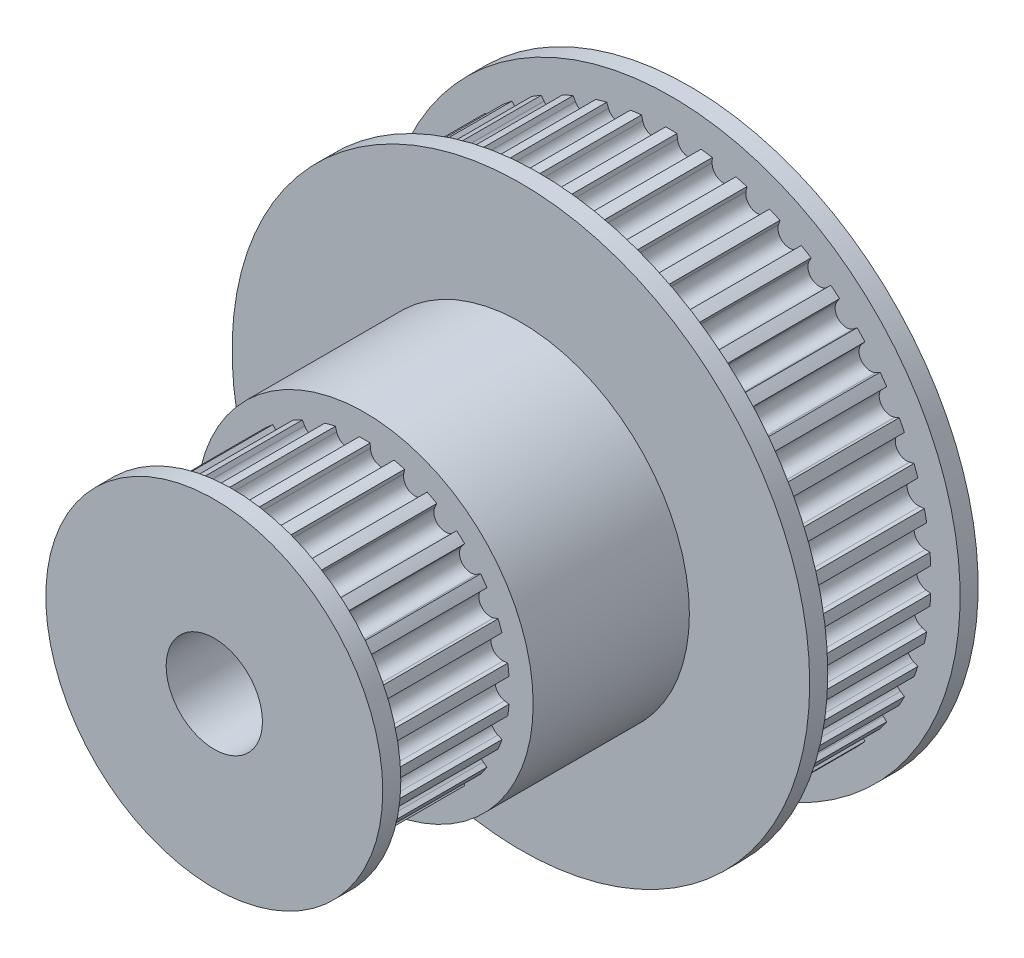
from build123d import *

# Parameters (mm, degrees)
SKETCH1_R               = 4
BOSS_EXTRUDE1_DEPTH     = 11
SKETCH2_R               = 4
BOSS_EXTRUDE2_DEPTH     = 11
SKETCH3_R               = 24
BOSS_EXTRUDE3_DEPTH     = 1.5
BOSS_EXTRUDE4_START     = 1.5
SKETCH4_R               = 24
BOSS_EXTRUDE4_DEPTH     = 1.5
SKETCH5_R               = 14
BOSS_EXTRUDE5_DEPTH     = 1.5
SKETCH6_R               = 14
BOSS_EXTRUDE6_DEPTH     = 12.98
CUT_EXTRUDE1_DEPTH      = 53.064098955
CUT_EXTRUDE1_DEPTH_BACK = 53.064098955
SKETCH7_R               = 4


with BuildPart() as part:
    # Sketch1 → Boss-Extrude1 (new body)
    with BuildSketch(Plane.XY):
        with BuildLine():
            Line((-0.473420512, 21.574806442), (-0.509853107, 21.1905942))
            ThreePointArc((-0.509853107, 21.1905942), (-1.390780384, 20.332489516), (-2.380347897, 21.062648851))
            Line((-2.380347897, 21.062648851), (-2.46875805, 21.438321615))
            ThreePointArc((-2.46875805, 21.438321615), (-2.938476287, 21.379002715), (-3.406780146, 21.309393446))
            Line((-3.406780146, 21.309393446), (-3.390556512, 20.923798873))
            ThreePointArc((-3.390556512, 20.923798873), (-4.146433546, 19.953733707), (-5.226207523, 20.542346206))
            Line((-5.226207523, 20.542346206), (-5.364948321, 20.90248142))
            ThreePointArc((-5.364948321, 20.90248142), (-5.822214322, 20.779755061), (-6.276677912, 20.647026769))
            Line((-6.276677912, 20.647026769), (-6.208100265, 20.267232762))
            ThreePointArc((-6.208100265, 20.267232762), (-6.824846496, 19.203277593), (-7.974712792, 19.639378519))
            Line((-7.974712792, 19.639378519), (-8.161199756, 19.977267545))
            ThreePointArc((-8.161199756, 19.977267545), (-8.597495519, 19.793419886), (-9.029653044, 19.600045049))
            Line((-9.029653044, 19.600045049), (-8.909998855, 19.233126452))
            ThreePointArc((-8.909998855, 19.233126452), (-9.376125469, 18.095100751), (-10.57466425, 18.37056637))
            Line((-10.57466425, 18.37056637), (-10.805423481, 18.679914973))
            ThreePointArc((-10.805423481, 18.679914973), (-11.212621642, 18.43837075), (-11.614422824, 18.187951574))
            Line((-11.614422824, 18.187951574), (-11.445921026, 17.840743387))
            ThreePointArc((-11.445921026, 17.840743387), (-11.752744965, 16.64984642), (-12.977629721, 16.759545327))
            Line((-12.977629721, 16.759545327), (-13.24836261, 17.03459093))
            ThreePointArc((-13.24836261, 17.03459093), (-13.618877839, 16.739849653), (-13.982837883, 16.437050974))
            Line((-13.982837883, 16.437050974), (-13.768627344, 16.116021029))
            ThreePointArc((-13.768627344, 16.116021029), (-13.910433059, 14.894436952), (-15.138846505, 14.836325665))
            Line((-15.138846505, 14.836325665), (-15.444509812, 15.071944688))
            ThreePointArc((-15.444509812, 15.071944688), (-15.771440109, 14.729496831), (-16.090779129, 14.379959215))
            Line((-16.090779129, 14.379959215), (-15.834850186, 14.091087691))
            ThreePointArc((-15.834850186, 14.091087691), (-15.808996105, 12.861572305), (-17.018055222, 12.636733327))
            Line((-17.018055222, 12.636733327), (-17.352955017, 12.828536634))
            ThreePointArc((-17.352955017, 12.828536634), (-17.630210291, 12.444761351), (-17.898979604, 12.054996024))
            Line((-17.898979604, 12.054996024), (-17.60609973, 11.803664051))
            ThreePointArc((-17.60609973, 11.803664051), (-17.413067465, 10.589120902), (-18.58024977, 10.201742557))
            Line((-18.58024977, 10.201742557), (-18.938147504, 10.346157215))
            ThreePointArc((-18.938147504, 10.346157215), (-19.160563013, 9.928203514), (-19.373755956, 9.505471065))
            Line((-19.373755956, 9.505471065), (-19.049380948, 9.296360483))
            ThreePointArc((-19.049380948, 9.296360483), (-18.692766325, 8.119414211), (-19.79632942, 7.576712626))
            Line((-19.79632942, 7.576712626), (-20.170558135, 7.671048462))
            ThreePointArc((-20.170558135, 7.671048462), (-20.333990699, 7.226702031), (-20.48763589, 6.778877166))
            Line((-20.48763589, 6.778877166), (-20.137808242, 6.615883309))
            ThreePointArc((-20.137808242, 6.615883309), (-19.624254316, 5.498458196), (-20.643640909, 4.810542874))
            Line((-20.643640909, 4.810542874), (-21.027229433, 4.853042591))
            ThreePointArc((-21.027229433, 4.853042591), (-21.128634612, 4.390580762), (-21.219869932, 3.926005611))
            Line((-21.219869932, 3.926005611), (-20.85110627, 3.812164746))
            ThreePointArc((-20.85110627, 3.812164746), (-20.19017958, 2.775076309), (-21.106400427, 1.95476181))
            Line((-21.106400427, 1.95476181), (-21.49220323, 1.944633719))
            ThreePointArc((-21.49220323, 1.944633719), (-21.529692039, 1.47267128), (-21.556817947, 1))
            Line((-21.556817947, 1), (-21.17598764, 0.937432767))
            ThreePointArc((-21.17598764, 0.937432767), (-20.38, 0), (-21.17598764, -0.937432767))
            Line((-21.17598764, -0.937432767), (-21.556817947, -1))
            ThreePointArc((-21.556817947, -1), (-21.529692039, -1.47267128), (-21.49220323, -1.944633719))
            Line((-21.49220323, -1.944633719), (-21.106400427, -1.95476181))
            ThreePointArc((-21.106400427, -1.95476181), (-20.19017958, -2.775076309), (-20.85110627, -3.812164746))
            Line((-20.85110627, -3.812164746), (-21.219869932, -3.926005611))
            ThreePointArc((-21.219869932, -3.926005611), (-21.128634612, -4.390580762), (-21.027229433, -4.853042591))
            Line((-21.027229433, -4.853042591), (-20.643640909, -4.810542874))
            ThreePointArc((-20.643640909, -4.810542874), (-19.624254316, -5.498458196), (-20.137808242, -6.615883309))
            Line((-20.137808242, -6.615883309), (-20.48763589, -6.778877166))
            ThreePointArc((-20.48763589, -6.778877166), (-20.333990699, -7.226702031), (-20.170558135, -7.671048462))
            Line((-20.170558135, -7.671048462), (-19.79632942, -7.576712626))
            ThreePointArc((-19.79632942, -7.576712626), (-18.692766325, -8.119414211), (-19.049380948, -9.296360483))
            Line((-19.049380948, -9.296360483), (-19.373755956, -9.505471065))
            ThreePointArc((-19.373755956, -9.505471065), (-19.160563013, -9.928203514), (-18.938147504, -10.346157215))
            Line((-18.938147504, -10.346157215), (-18.58024977, -10.201742557))
            ThreePointArc((-18.58024977, -10.201742557), (-17.413067465, -10.589120902), (-17.60609973, -11.803664051))
            Line((-17.60609973, -11.803664051), (-17.898979604, -12.054996024))
            ThreePointArc((-17.898979604, -12.054996024), (-17.630210291, -12.444761351), (-17.352955017, -12.828536634))
            Line((-17.352955017, -12.828536634), (-17.018055222, -12.636733327))
            ThreePointArc((-17.018055222, -12.636733327), (-15.808996105, -12.861572305), (-15.834850186, -14.091087691))
            Line((-15.834850186, -14.091087691), (-16.090779129, -14.379959215))
            ThreePointArc((-16.090779129, -14.379959215), (-15.771440109, -14.729496831), (-15.444509812, -15.071944688))
            Line((-15.444509812, -15.071944688), (-15.138846505, -14.836325665))
            ThreePointArc((-15.138846505, -14.836325665), (-13.910433059, -14.894436952), (-13.768627344, -16.116021029))
            Line((-13.768627344, -16.116021029), (-13.982837883, -16.437050974))
            ThreePointArc((-13.982837883, -16.437050974), (-13.618877839, -16.739849653), (-13.24836261, -17.03459093))
            Line((-13.24836261, -17.03459093), (-12.977629721, -16.759545327))
            ThreePointArc((-12.977629721, -16.759545327), (-11.752744965, -16.64984642), (-11.445921026, -17.840743387))
            Line((-11.445921026, -17.840743387), (-11.614422824, -18.187951574))
            ThreePointArc((-11.614422824, -18.187951574), (-11.212621642, -18.43837075), (-10.805423481, -18.679914973))
            Line((-10.805423481, -18.679914973), (-10.57466425, -18.37056637))
            ThreePointArc((-10.57466425, -18.37056637), (-9.376125469, -18.095100751), (-8.909998855, -19.233126452))
            Line((-8.909998855, -19.233126452), (-9.029653044, -19.600045049))
            ThreePointArc((-9.029653044, -19.600045049), (-8.597495519, -19.793419886), (-8.161199756, -19.977267545))
            Line((-8.161199756, -19.977267545), (-7.974712792, -19.639378519))
            ThreePointArc((-7.974712792, -19.639378519), (-6.824846496, -19.203277593), (-6.208100265, -20.267232762))
            Line((-6.208100265, -20.267232762), (-6.276677912, -20.647026769))
            ThreePointArc((-6.276677912, -20.647026769), (-5.822214322, -20.779755061), (-5.364948321, -20.90248142))
            Line((-5.364948321, -20.90248142), (-5.226207523, -20.542346206))
            ThreePointArc((-5.226207523, -20.542346206), (-4.146433546, -19.953733707), (-3.390556512, -20.923798873))
            Line((-3.390556512, -20.923798873), (-3.406780146, -21.309393446))
            ThreePointArc((-3.406780146, -21.309393446), (-2.938476287, -21.379002715), (-2.46875805, -21.438321615))
            Line((-2.46875805, -21.438321615), (-2.380347897, -21.062648851))
            ThreePointArc((-2.380347897, -21.062648851), (-1.390780384, -20.332489516), (-0.509853107, -21.1905942))
            Line((-0.509853107, -21.1905942), (-0.473420512, -21.574806442))
            ThreePointArc((-0.473420512, -21.574806442), (0, -21.58), (0.473420512, -21.574806442))
            Line((0.473420512, -21.574806442), (0.509853107, -21.1905942))
            ThreePointArc((0.509853107, -21.1905942), (1.390780384, -20.332489516), (2.380347897, -21.062648851))
            Line((2.380347897, -21.062648851), (2.46875805, -21.438321615))
            ThreePointArc((2.46875805, -21.438321615), (2.938476287, -21.379002715), (3.406780146, -21.309393446))
            Line((3.406780146, -21.309393446), (3.390556512, -20.923798873))
            ThreePointArc((3.390556512, -20.923798873), (4.146433546, -19.953733707), (5.226207523, -20.542346206))
            Line((5.226207523, -20.542346206), (5.364948321, -20.90248142))
            ThreePointArc((5.364948321, -20.90248142), (5.822214322, -20.779755061), (6.276677912, -20.647026769))
            Line((6.276677912, -20.647026769), (6.208100265, -20.267232762))
            ThreePointArc((6.208100265, -20.267232762), (6.824846496, -19.203277593), (7.974712792, -19.639378519))
            Line((7.974712792, -19.639378519), (8.161199756, -19.977267545))
            ThreePointArc((8.161199756, -19.977267545), (8.597495519, -19.793419886), (9.029653044, -19.600045049))
            Line((9.029653044, -19.600045049), (8.909998855, -19.233126452))
            ThreePointArc((8.909998855, -19.233126452), (9.376125469, -18.095100751), (10.57466425, -18.37056637))
            Line((10.57466425, -18.37056637), (10.805423481, -18.679914973))
            ThreePointArc((10.805423481, -18.679914973), (11.212621642, -18.43837075), (11.614422824, -18.187951574))
            Line((11.614422824, -18.187951574), (11.445921026, -17.840743387))
            ThreePointArc((11.445921026, -17.840743387), (11.752744965, -16.64984642), (12.977629721, -16.759545327))
            Line((12.977629721, -16.759545327), (13.24836261, -17.03459093))
            ThreePointArc((13.24836261, -17.03459093), (13.618877839, -16.739849653), (13.982837883, -16.437050974))
            Line((13.982837883, -16.437050974), (13.768627344, -16.116021029))
            ThreePointArc((13.768627344, -16.116021029), (13.910433059, -14.894436952), (15.138846505, -14.836325665))
            Line((15.138846505, -14.836325665), (15.444509812, -15.071944688))
            ThreePointArc((15.444509812, -15.071944688), (15.771440109, -14.729496831), (16.090779129, -14.379959215))
            Line((16.090779129, -14.379959215), (15.834850186, -14.091087691))
            ThreePointArc((15.834850186, -14.091087691), (15.808996105, -12.861572305), (17.018055222, -12.636733327))
            Line((17.018055222, -12.636733327), (17.352955017, -12.828536634))
            ThreePointArc((17.352955017, -12.828536634), (17.630210291, -12.444761351), (17.898979604, -12.054996024))
            Line((17.898979604, -12.054996024), (17.60609973, -11.803664051))
            ThreePointArc((17.60609973, -11.803664051), (17.413067465, -10.589120902), (18.58024977, -10.201742557))
            Line((18.58024977, -10.201742557), (18.938147504, -10.346157215))
            ThreePointArc((18.938147504, -10.346157215), (19.160563013, -9.928203514), (19.373755956, -9.505471065))
            Line((19.373755956, -9.505471065), (19.049380948, -9.296360483))
            ThreePointArc((19.049380948, -9.296360483), (18.692766325, -8.119414211), (19.79632942, -7.576712626))
            Line((19.79632942, -7.576712626), (20.170558135, -7.671048462))
            ThreePointArc((20.170558135, -7.671048462), (20.333990699, -7.226702031), (20.48763589, -6.778877166))
            Line((20.48763589, -6.778877166), (20.137808242, -6.615883309))
            ThreePointArc((20.137808242, -6.615883309), (19.624254316, -5.498458196), (20.643640909, -4.810542874))
            Line((20.643640909, -4.810542874), (21.027229433, -4.853042591))
            ThreePointArc((21.027229433, -4.853042591), (21.128634612, -4.390580762), (21.219869932, -3.926005611))
            Line((21.219869932, -3.926005611), (20.85110627, -3.812164746))
            ThreePointArc((20.85110627, -3.812164746), (20.19017958, -2.775076309), (21.106400427, -1.95476181))
            Line((21.106400427, -1.95476181), (21.49220323, -1.944633719))
            ThreePointArc((21.49220323, -1.944633719), (21.529692039, -1.47267128), (21.556817947, -1))
            Line((21.556817947, -1), (21.17598764, -0.937432767))
            ThreePointArc((21.17598764, -0.937432767), (20.38, 0), (21.17598764, 0.937432767))
            Line((21.17598764, 0.937432767), (21.556817947, 1))
            ThreePointArc((21.556817947, 1), (21.529692039, 1.47267128), (21.49220323, 1.944633719))
            Line((21.49220323, 1.944633719), (21.106400427, 1.95476181))
            ThreePointArc((21.106400427, 1.95476181), (20.19017958, 2.775076309), (20.85110627, 3.812164746))
            Line((20.85110627, 3.812164746), (21.219869932, 3.926005611))
            ThreePointArc((21.219869932, 3.926005611), (21.128634612, 4.390580762), (21.027229433, 4.853042591))
            Line((21.027229433, 4.853042591), (20.643640909, 4.810542874))
            ThreePointArc((20.643640909, 4.810542874), (19.624254316, 5.498458196), (20.137808242, 6.615883309))
            Line((20.137808242, 6.615883309), (20.48763589, 6.778877166))
            ThreePointArc((20.48763589, 6.778877166), (20.333990699, 7.226702031), (20.170558135, 7.671048462))
            Line((20.170558135, 7.671048462), (19.79632942, 7.576712626))
            ThreePointArc((19.79632942, 7.576712626), (18.692766325, 8.119414211), (19.049380948, 9.296360483))
            Line((19.049380948, 9.296360483), (19.373755956, 9.505471065))
            ThreePointArc((19.373755956, 9.505471065), (19.160563013, 9.928203514), (18.938147504, 10.346157215))
            Line((18.938147504, 10.346157215), (18.58024977, 10.201742557))
            ThreePointArc((18.58024977, 10.201742557), (17.413067465, 10.589120902), (17.60609973, 11.803664051))
            Line((17.60609973, 11.803664051), (17.898979604, 12.054996024))
            ThreePointArc((17.898979604, 12.054996024), (17.630210291, 12.444761351), (17.352955017, 12.828536634))
            Line((17.352955017, 12.828536634), (17.018055222, 12.636733327))
            ThreePointArc((17.018055222, 12.636733327), (15.808996105, 12.861572305), (15.834850186, 14.091087691))
            Line((15.834850186, 14.091087691), (16.090779129, 14.379959215))
            ThreePointArc((16.090779129, 14.379959215), (15.771440109, 14.729496831), (15.444509812, 15.071944688))
            Line((15.444509812, 15.071944688), (15.138846505, 14.836325665))
            ThreePointArc((15.138846505, 14.836325665), (13.910433059, 14.894436952), (13.768627344, 16.116021029))
            Line((13.768627344, 16.116021029), (13.982837883, 16.437050974))
            ThreePointArc((13.982837883, 16.437050974), (13.618877839, 16.739849653), (13.24836261, 17.03459093))
            Line((13.24836261, 17.03459093), (12.977629721, 16.759545327))
            ThreePointArc((12.977629721, 16.759545327), (11.752744965, 16.64984642), (11.445921026, 17.840743387))
            Line((11.445921026, 17.840743387), (11.614422824, 18.187951574))
            ThreePointArc((11.614422824, 18.187951574), (11.212621642, 18.43837075), (10.805423481, 18.679914973))
            Line((10.805423481, 18.679914973), (10.57466425, 18.37056637))
            ThreePointArc((10.57466425, 18.37056637), (9.376125469, 18.095100751), (8.909998855, 19.233126452))
            Line((8.909998855, 19.233126452), (9.029653044, 19.600045049))
            ThreePointArc((9.029653044, 19.600045049), (8.597495519, 19.793419886), (8.161199756, 19.977267545))
            Line((8.161199756, 19.977267545), (7.974712792, 19.639378519))
            ThreePointArc((7.974712792, 19.639378519), (6.824846496, 19.203277593), (6.208100265, 20.267232762))
            Line((6.208100265, 20.267232762), (6.276677912, 20.647026769))
            ThreePointArc((6.276677912, 20.647026769), (5.822214322, 20.779755061), (5.364948321, 20.90248142))
            Line((5.364948321, 20.90248142), (5.226207523, 20.542346206))
            ThreePointArc((5.226207523, 20.542346206), (4.146433546, 19.953733707), (3.390556512, 20.923798873))
            Line((3.390556512, 20.923798873), (3.406780146, 21.309393446))
            ThreePointArc((3.406780146, 21.309393446), (2.938476287, 21.379002715), (2.46875805, 21.438321615))
            Line((2.46875805, 21.438321615), (2.380347897, 21.062648851))
            ThreePointArc((2.380347897, 21.062648851), (1.390780384, 20.332489516), (0.509853107, 21.1905942))
            Line((0.509853107, 21.1905942), (0.473420512, 21.574806442))
            ThreePointArc((0.473420512, 21.574806442), (0, 21.58), (-0.473420512, 21.574806442))
        make_face()
        with Locations(Location((0, 0, 0), (0, 0, 180))):
            Circle(SKETCH1_R, mode=Mode.SUBTRACT)
    extrude(amount=BOSS_EXTRUDE1_DEPTH)

    # Sketch3 → Boss-Extrude3 (add)
    with BuildSketch(Plane(origin=(0, 0, 0), x_dir=(-1, 0, 0), z_dir=(0, 0, -1))):
        Circle(SKETCH3_R)
    extrude(amount=BOSS_EXTRUDE3_DEPTH)

    # Sketch4 → Boss-Extrude4 (add)
    with BuildSketch(Plane.XY.offset(11).offset(BOSS_EXTRUDE4_START)):
        with Locations(Location((0, 0, 0), (0, 0, 180))):
            Circle(SKETCH4_R)
    extrude(amount=-BOSS_EXTRUDE4_DEPTH)


with BuildPart() as body_2:
    # Sketch2 → Boss-Extrude2 (new body)
    with BuildSketch(Plane.XY.offset(36.48)):
        with BuildLine():
            Line((-0.452933644, 12.026473968), (-0.471714399, 11.651546548))
            ThreePointArc((-0.471714399, 11.651546548), (-1.306014931, 10.756000651), (-2.330390367, 11.425862426))
            Line((-2.330390367, 11.425862426), (-2.438351392, 11.785400608))
            ThreePointArc((-2.438351392, 11.785400608), (-2.88016402, 11.685284773), (-3.317895822, 11.568612376))
            Line((-3.317895822, 11.568612376), (-3.246404838, 11.200085137))
            ThreePointArc((-3.246404838, 11.200085137), (-3.842143951, 10.130900989), (-4.997061314, 10.536148711))
            Line((-4.997061314, 10.536148711), (-5.187928307, 10.859402602))
            ThreePointArc((-5.187928307, 10.859402602), (-5.592943376, 10.656463269), (-5.990033955, 10.438425083))
            Line((-5.990033955, 10.438425083), (-5.832426028, 10.097715488))
            ThreePointArc((-5.832426028, 10.097715488), (-6.154981531, 8.917030187), (-7.373321222, 9.03411233))
            Line((-7.373321222, 9.03411233), (-7.636001687, 9.30229559))
            ThreePointArc((-7.636001687, 9.30229559), (-7.980681192, 9.008326854), (-8.314053088, 8.701594466))
            Line((-8.314053088, 8.701594466), (-8.079487817, 8.408503318))
            ThreePointArc((-8.079487817, 8.408503318), (-8.110113956, 7.184934002), (-9.321070501, 7.007046178))
            Line((-9.321070501, 7.007046178), (-9.640298404, 7.20457297))
            ThreePointArc((-9.640298404, 7.20457297), (-9.904610826, 6.836659227), (-10.154889675, 6.459058808))
            Line((-10.154889675, 6.459058808), (-9.856999142, 6.230619499))
            ThreePointArc((-9.856999142, 6.230619499), (-9.593916038, 5.035275569), (-10.727113044, 4.572755972))
            Line((-10.727113044, 4.572755972), (-11.084336019, 4.688146757))
            ThreePointArc((-11.084336019, 4.688146757), (-11.252920481, 4.267669816), (-11.405560986, 3.84114613))
            Line((-11.405560986, 3.84114613), (-11.061657506, 3.690634723))
            ThreePointArc((-11.061657506, 3.690634723), (-10.520154592, 2.592985223), (-11.509734768, 1.87271381))
            Line((-11.509734768, 1.87271381), (-11.884192315, 1.899262495))
            ThreePointArc((-11.884192315, 1.899262495), (-11.9472513, 1.450658947), (-11.99338255, 1))
            Line((-11.99338255, 1), (-11.623452543, 0.936163671))
            ThreePointArc((-11.623452543, 0.936163671), (-10.835, 0), (-11.623452543, -0.936163671))
            Line((-11.623452543, -0.936163671), (-11.99338255, -1))
            ThreePointArc((-11.99338255, -1), (-11.9472513, -1.450658947), (-11.884192315, -1.899262495))
            Line((-11.884192315, -1.899262495), (-11.509734768, -1.87271381))
            ThreePointArc((-11.509734768, -1.87271381), (-10.520154592, -2.592985223), (-11.061657506, -3.690634723))
            Line((-11.061657506, -3.690634723), (-11.405560986, -3.84114613))
            ThreePointArc((-11.405560986, -3.84114613), (-11.252920481, -4.267669816), (-11.084336019, -4.688146757))
            Line((-11.084336019, -4.688146757), (-10.727113044, -4.572755972))
            ThreePointArc((-10.727113044, -4.572755972), (-9.593916038, -5.035275569), (-9.856999142, -6.230619499))
            Line((-9.856999142, -6.230619499), (-10.154889675, -6.459058808))
            ThreePointArc((-10.154889675, -6.459058808), (-9.904610826, -6.836659227), (-9.640298404, -7.20457297))
            Line((-9.640298404, -7.20457297), (-9.321070501, -7.007046178))
            ThreePointArc((-9.321070501, -7.007046178), (-8.110113956, -7.184934002), (-8.079487817, -8.408503318))
            Line((-8.079487817, -8.408503318), (-8.314053088, -8.701594466))
            ThreePointArc((-8.314053088, -8.701594466), (-7.980681192, -9.008326854), (-7.636001687, -9.30229559))
            Line((-7.636001687, -9.30229559), (-7.373321222, -9.03411233))
            ThreePointArc((-7.373321222, -9.03411233), (-6.154981531, -8.917030187), (-5.832426028, -10.097715488))
            Line((-5.832426028, -10.097715488), (-5.990033955, -10.438425083))
            ThreePointArc((-5.990033955, -10.438425083), (-5.592943376, -10.656463269), (-5.187928307, -10.859402602))
            Line((-5.187928307, -10.859402602), (-4.997061314, -10.536148711))
            ThreePointArc((-4.997061314, -10.536148711), (-3.842143951, -10.130900989), (-3.246404838, -11.200085137))
            Line((-3.246404838, -11.200085137), (-3.317895822, -11.568612376))
            ThreePointArc((-3.317895822, -11.568612376), (-2.88016402, -11.685284773), (-2.438351392, -11.785400608))
            Line((-2.438351392, -11.785400608), (-2.330390367, -11.425862426))
            ThreePointArc((-2.330390367, -11.425862426), (-1.306014931, -10.756000651), (-0.471714399, -11.651546548))
            Line((-0.471714399, -11.651546548), (-0.452933644, -12.026473968))
            ThreePointArc((-0.452933644, -12.026473968), (0, -12.035), (0.452933644, -12.026473968))
            Line((0.452933644, -12.026473968), (0.471714399, -11.651546548))
            ThreePointArc((0.471714399, -11.651546548), (1.306014931, -10.756000651), (2.330390367, -11.425862426))
            Line((2.330390367, -11.425862426), (2.438351392, -11.785400608))
            ThreePointArc((2.438351392, -11.785400608), (2.88016402, -11.685284773), (3.317895822, -11.568612376))
            Line((3.317895822, -11.568612376), (3.246404838, -11.200085137))
            ThreePointArc((3.246404838, -11.200085137), (3.842143951, -10.130900989), (4.997061314, -10.536148711))
            Line((4.997061314, -10.536148711), (5.187928307, -10.859402602))
            ThreePointArc((5.187928307, -10.859402602), (5.592943376, -10.656463269), (5.990033955, -10.438425083))
            Line((5.990033955, -10.438425083), (5.832426028, -10.097715488))
            ThreePointArc((5.832426028, -10.097715488), (6.154981531, -8.917030187), (7.373321222, -9.03411233))
            Line((7.373321222, -9.03411233), (7.636001687, -9.30229559))
            ThreePointArc((7.636001687, -9.30229559), (7.980681192, -9.008326854), (8.314053088, -8.701594466))
            Line((8.314053088, -8.701594466), (8.079487817, -8.408503318))
            ThreePointArc((8.079487817, -8.408503318), (8.110113956, -7.184934002), (9.321070501, -7.007046178))
            Line((9.321070501, -7.007046178), (9.640298404, -7.20457297))
            ThreePointArc((9.640298404, -7.20457297), (9.904610826, -6.836659227), (10.154889675, -6.459058808))
            Line((10.154889675, -6.459058808), (9.856999142, -6.230619499))
            ThreePointArc((9.856999142, -6.230619499), (9.593916038, -5.035275569), (10.727113044, -4.572755972))
            Line((10.727113044, -4.572755972), (11.084336019, -4.688146757))
            ThreePointArc((11.084336019, -4.688146757), (11.252920481, -4.267669816), (11.405560986, -3.84114613))
            Line((11.405560986, -3.84114613), (11.061657506, -3.690634723))
            ThreePointArc((11.061657506, -3.690634723), (10.520154592, -2.592985223), (11.509734768, -1.87271381))
            Line((11.509734768, -1.87271381), (11.884192315, -1.899262495))
            ThreePointArc((11.884192315, -1.899262495), (11.9472513, -1.450658947), (11.99338255, -1))
            Line((11.99338255, -1), (11.623452543, -0.936163671))
            ThreePointArc((11.623452543, -0.936163671), (10.835, 0), (11.623452543, 0.936163671))
            Line((11.623452543, 0.936163671), (11.99338255, 1))
            ThreePointArc((11.99338255, 1), (11.9472513, 1.450658947), (11.884192315, 1.899262495))
            Line((11.884192315, 1.899262495), (11.509734768, 1.87271381))
            ThreePointArc((11.509734768, 1.87271381), (10.520154592, 2.592985223), (11.061657506, 3.690634723))
            Line((11.061657506, 3.690634723), (11.405560986, 3.84114613))
            ThreePointArc((11.405560986, 3.84114613), (11.252920481, 4.267669816), (11.084336019, 4.688146757))
            Line((11.084336019, 4.688146757), (10.727113044, 4.572755972))
            ThreePointArc((10.727113044, 4.572755972), (9.593916038, 5.035275569), (9.856999142, 6.230619499))
            Line((9.856999142, 6.230619499), (10.154889675, 6.459058808))
            ThreePointArc((10.154889675, 6.459058808), (9.904610826, 6.836659227), (9.640298404, 7.20457297))
            Line((9.640298404, 7.20457297), (9.321070501, 7.007046178))
            ThreePointArc((9.321070501, 7.007046178), (8.110113956, 7.184934002), (8.079487817, 8.408503318))
            Line((8.079487817, 8.408503318), (8.314053088, 8.701594466))
            ThreePointArc((8.314053088, 8.701594466), (7.980681192, 9.008326854), (7.636001687, 9.30229559))
            Line((7.636001687, 9.30229559), (7.373321222, 9.03411233))
            ThreePointArc((7.373321222, 9.03411233), (6.154981531, 8.917030187), (5.832426028, 10.097715488))
            Line((5.832426028, 10.097715488), (5.990033955, 10.438425083))
            ThreePointArc((5.990033955, 10.438425083), (5.592943376, 10.656463269), (5.187928307, 10.859402602))
            Line((5.187928307, 10.859402602), (4.997061314, 10.536148711))
            ThreePointArc((4.997061314, 10.536148711), (3.842143951, 10.130900989), (3.246404838, 11.200085137))
            Line((3.246404838, 11.200085137), (3.317895822, 11.568612376))
            ThreePointArc((3.317895822, 11.568612376), (2.88016402, 11.685284773), (2.438351392, 11.785400608))
            Line((2.438351392, 11.785400608), (2.330390367, 11.425862426))
            ThreePointArc((2.330390367, 11.425862426), (1.306014931, 10.756000651), (0.471714399, 11.651546548))
            Line((0.471714399, 11.651546548), (0.452933644, 12.026473968))
            ThreePointArc((0.452933644, 12.026473968), (0, 12.035), (-0.452933644, 12.026473968))
        make_face()
        with Locations(Location((0, 0, 0), (0, 0, 180))):
            Circle(SKETCH2_R, mode=Mode.SUBTRACT)
    extrude(amount=-BOSS_EXTRUDE2_DEPTH)

    # Sketch5 → Boss-Extrude5 (add)
    with BuildSketch(Plane.XY.offset(36.48)):
        Circle(SKETCH5_R)
    extrude(amount=BOSS_EXTRUDE5_DEPTH)

    # Sketch6 → Boss-Extrude6 (add)
    with BuildSketch(Plane(origin=(0, 0, 25.48), x_dir=(-1, 0, 0), z_dir=(0, 0, -1))):
        with Locations(Location((0, 0, 0), (0, 0, 180))):
            Circle(SKETCH6_R)
    extrude(amount=BOSS_EXTRUDE6_DEPTH)


with BuildPart() as cut_extrude1_tool:
    # Sketch7 → Cut-Extrude1 (new, two sides: drawn at the far end of the back side and taken through both)
    with BuildSketch(Plane(origin=(0, 0, -1.5), x_dir=(-1, 0, 0), z_dir=(0, 0, -1)).offset(-CUT_EXTRUDE1_DEPTH_BACK)):
        with Locations(Location((0, 0, 0), (0, 0, 180))):
            Circle(SKETCH7_R)
    extrude(amount=CUT_EXTRUDE1_DEPTH + CUT_EXTRUDE1_DEPTH_BACK)


with BuildPart() as part_1:
    add(part.part)

    # Cut-Extrude1: cut by cut_extrude1_tool
    add(cut_extrude1_tool.part, mode=Mode.SUBTRACT)


with BuildPart() as body_2_1:
    add(body_2.part)

    # Cut-Extrude1: cut by cut_extrude1_tool
    add(cut_extrude1_tool.part, mode=Mode.SUBTRACT)


solid = Compound([part_1.part, body_2_1.part])
